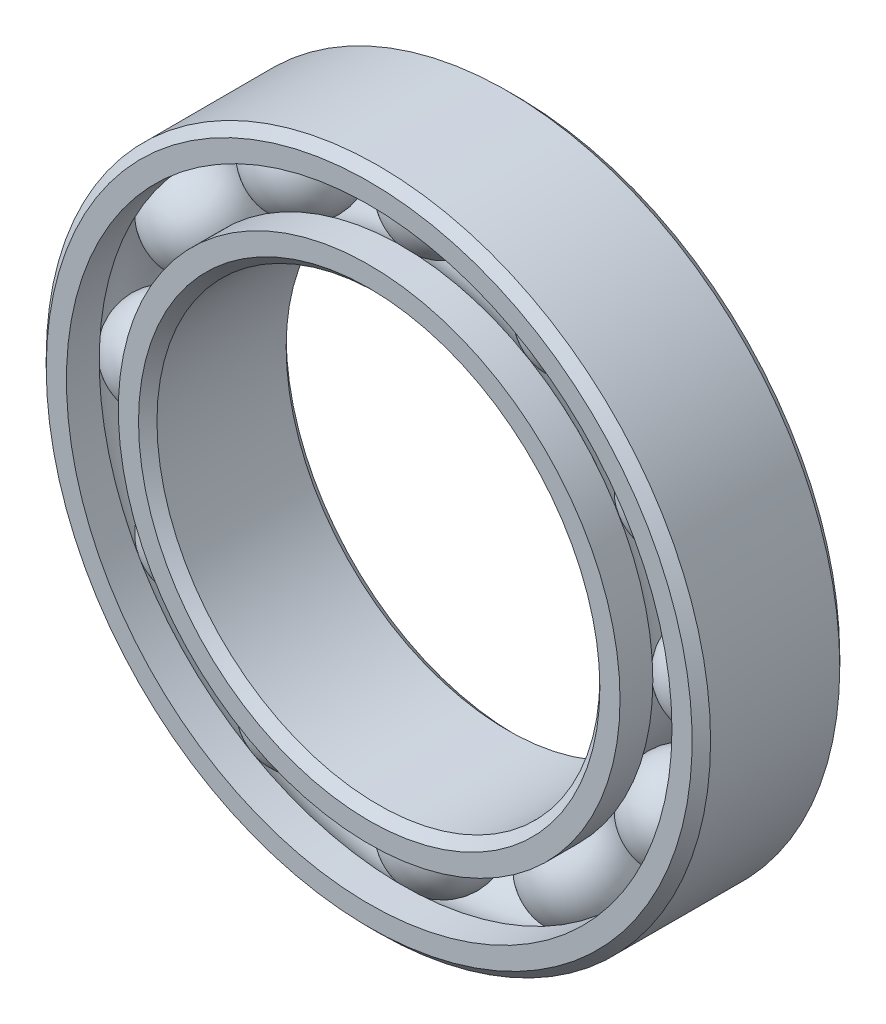
from build123d import *

# Parameters (mm, degrees)
CIRPATTERN1_COUNT = 12


with BuildPart() as part:
    # Sketch1 → Revolve1 (revolve)
    with BuildSketch(Plane(origin=(0, 0, 0), x_dir=(0, 0, -1), z_dir=(1, 0, 0))):
        with BuildLine():
            Line((1.75, 9), (-1.75, 9))
            Line((-1.75, 9), (-2, 8.75))
            Line((-2, 8.75), (-2, 8.203296703))
            Line((-2, 8.203296703), (-1.111111111, 8.203296703))
            ThreePointArc((-1.111111111, 8.203296703), (0, 8.814988271), (1.111111111, 8.203296703))
            Line((1.111111111, 8.203296703), (2, 8.203296703))
            Line((2, 8.203296703), (2, 8.75))
            Line((2, 8.75), (1.75, 9))
        make_face()
    revolve(axis=Axis((0, 0, 2), (0, 0, -1)))


with BuildPart() as body_2:
    # Sketch3 → Revolve3 (revolve)
    with BuildSketch(Plane(origin=(0, 0, 0), x_dir=(0, 0, -1), z_dir=(1, 0, 0))):
        with BuildLine():
            Line((-2, 6.796703297), (-1.111111111, 6.796703297))
            ThreePointArc((-1.111111111, 6.796703297), (0, 6.185011729), (1.111111111, 6.796703297))
            Line((1.111111111, 6.796703297), (2, 6.796703297))
            Line((2, 6.796703297), (2, 6.25))
            Line((2, 6.25), (1.75, 6))
            Line((1.75, 6), (-1.75, 6))
            Line((-1.75, 6), (-2, 6.25))
            Line((-2, 6.25), (-2, 6.796703297))
        make_face()
    revolve(axis=Axis((0, 0, 2), (0, 0, -1)))


with BuildPart() as body_3:
    # Sketch4 → Revolve4 (revolve)
    with BuildSketch(Plane(origin=(0, 0, 0), x_dir=(0, 0, -1), z_dir=(1, 0, 0))):
        with BuildLine():
            Line((-1.314988271, 7.5), (1.314988271, 7.5))
            ThreePointArc((1.314988271, 7.5), (0, 8.814988271), (-1.314988271, 7.5))
        make_face()
    revolve(axis=Axis((0, 7.5, 1.314988271), (0, 0, -1)))


with BuildPart() as cirpattern1_1:
    # CirPattern1: pattern copy
    add(body_3.part.rotate(Axis((0, 0, -2), (0, 0, 1)), 1 * 360 / CIRPATTERN1_COUNT))


with BuildPart() as cirpattern1_2:
    # CirPattern1: pattern copy
    add(body_3.part.rotate(Axis((0, 0, -2), (0, 0, 1)), 2 * 360 / CIRPATTERN1_COUNT))


with BuildPart() as cirpattern1_3:
    # CirPattern1: pattern copy
    add(body_3.part.rotate(Axis((0, 0, -2), (0, 0, 1)), 3 * 360 / CIRPATTERN1_COUNT))


with BuildPart() as cirpattern1_4:
    # CirPattern1: pattern copy
    add(body_3.part.rotate(Axis((0, 0, -2), (0, 0, 1)), 4 * 360 / CIRPATTERN1_COUNT))


with BuildPart() as cirpattern1_5:
    # CirPattern1: pattern copy
    add(body_3.part.rotate(Axis((0, 0, -2), (0, 0, 1)), 5 * 360 / CIRPATTERN1_COUNT))


with BuildPart() as cirpattern1_6:
    # CirPattern1: pattern copy
    add(body_3.part.rotate(Axis((0, 0, -2), (0, 0, 1)), 6 * 360 / CIRPATTERN1_COUNT))


with BuildPart() as cirpattern1_7:
    # CirPattern1: pattern copy
    add(body_3.part.rotate(Axis((0, 0, -2), (0, 0, 1)), 7 * 360 / CIRPATTERN1_COUNT))


with BuildPart() as cirpattern1_8:
    # CirPattern1: pattern copy
    add(body_3.part.rotate(Axis((0, 0, -2), (0, 0, 1)), 8 * 360 / CIRPATTERN1_COUNT))


with BuildPart() as cirpattern1_9:
    # CirPattern1: pattern copy
    add(body_3.part.rotate(Axis((0, 0, -2), (0, 0, 1)), 9 * 360 / CIRPATTERN1_COUNT))


with BuildPart() as cirpattern1_10:
    # CirPattern1: pattern copy
    add(body_3.part.rotate(Axis((0, 0, -2), (0, 0, 1)), 10 * 360 / CIRPATTERN1_COUNT))


with BuildPart() as cirpattern1_11:
    # CirPattern1: pattern copy
    add(body_3.part.rotate(Axis((0, 0, -2), (0, 0, 1)), 11 * 360 / CIRPATTERN1_COUNT))


solid = Compound([part.part, body_2.part, body_3.part, cirpattern1_1.part, cirpattern1_2.part, cirpattern1_3.part, cirpattern1_4.part, cirpattern1_5.part, cirpattern1_6.part, cirpattern1_7.part, cirpattern1_8.part, cirpattern1_9.part, cirpattern1_10.part, cirpattern1_11.part])
